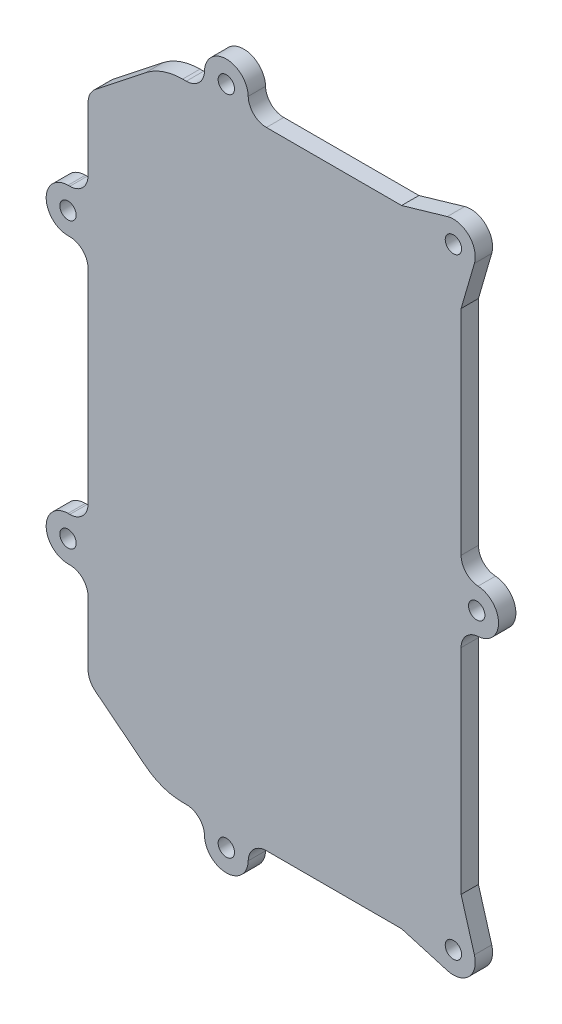
from build123d import *

# Parameters (mm, degrees)
BOSS_EXTRUDE1_DEPTH  = 4.7625
M4_CLEARANCE_HOLE1_D = 4.5


with BuildPart() as part:
    # Sketch1 → Boss-Extrude1 (new body)
    with BuildSketch(Plane.XY):
        with BuildLine():
            Line((-94.022602581, 36.539962058), (-94.022602581, 19.178370731))
            ThreePointArc((-94.022602581, 19.178370731), (-93.488675507, 16.852246076), (-91.993785217, 14.99180606))
            Line((-91.993785217, 14.99180606), (-78.162107839, 4.072060761))
            ThreePointArc((-78.162107839, 4.072060761), (-73.397757976, 1.461750489), (-68.040838029, 0.558335853))
            Line((-68.040838029, 0.558335853), (-67.038691488, 0.558335853))
            ThreePointArc((-67.038691488, 0.558335853), (-63.538253204, -0.87137959), (-62.039667189, -4.342891419))
            ThreePointArc((-62.039667189, -4.342891419), (-56.040838029, -10.224364147), (-50.04200887, -4.342891419))
            ThreePointArc((-50.04200887, -4.342891419), (-48.543422854, -0.87137959), (-45.04298457, 0.558335853))
            Line((-45.04298457, 0.558335853), (-7.916602581, 0.558335853))
            Line((-7.916602581, 0.558335853), (4.631523913, -3.09333052))
            ThreePointArc((4.631523913, -3.09333052), (10.550693091, -1.574959819), (12.069063792, 4.344209359))
            Line((12.069063792, 4.344209359), (8.417397419, 16.892335853))
            Line((8.417397419, 16.892335853), (8.417397419, 75.581748009))
            ThreePointArc((8.417397419, 75.581748009), (9.768409389, 79.000064314), (13.091351964, 80.57110612))
            ThreePointArc((13.091351964, 80.57110612), (18.700097419, 86.558335853), (13.091351964, 92.545565587))
            ThreePointArc((13.091351964, 92.545565587), (9.768409389, 94.116607393), (8.417397419, 97.534923698))
            Line((8.417397419, 97.534923698), (8.417397419, 156.224335853))
            Line((8.417397419, 156.224335853), (12.069063792, 168.772462348))
            ThreePointArc((12.069063792, 168.772462348), (10.550693091, 174.691631526), (4.631523913, 176.210002227))
            Line((4.631523913, 176.210002227), (-7.916602581, 172.558335853))
            Line((-7.916602581, 172.558335853), (-45.04298457, 172.558335853))
            ThreePointArc((-45.04298457, 172.558335853), (-48.543422854, 173.988051296), (-50.04200887, 177.459563126))
            ThreePointArc((-50.04200887, 177.459563126), (-56.040838029, 183.341035853), (-62.039667189, 177.459563126))
            ThreePointArc((-62.039667189, 177.459563126), (-63.538253204, 173.988051296), (-67.038691488, 172.558335853))
            Line((-67.038691488, 172.558335853), (-68.040838029, 172.558335853))
            ThreePointArc((-68.040838029, 172.558335853), (-73.397757976, 171.654921218), (-78.162107839, 169.044610946))
            Line((-78.162107839, 169.044610946), (-91.993785217, 158.124865647))
            ThreePointArc((-91.993785217, 158.124865647), (-93.488675507, 156.264425631), (-94.022602581, 153.938300976))
            Line((-94.022602581, 153.938300976), (-94.022602581, 136.576709649))
            ThreePointArc((-94.022602581, 136.576709649), (-95.487068676, 133.041175743), (-99.022602581, 131.576709649))
            Line((-99.022602581, 131.576709649), (-99.522602581, 131.576709649))
            ThreePointArc((-99.522602581, 131.576709649), (-105.522602581, 125.576709649), (-99.522602581, 119.576709649))
            Line((-99.522602581, 119.576709649), (-99.022602581, 119.576709649))
            ThreePointArc((-99.022602581, 119.576709649), (-95.487068676, 118.112243554), (-94.022602581, 114.576709649))
            Line((-94.022602581, 114.576709649), (-94.022602581, 58.539962058))
            ThreePointArc((-94.022602581, 58.539962058), (-95.487068676, 55.004428152), (-99.022602581, 53.539962058))
            Line((-99.022602581, 53.539962058), (-99.522602581, 53.539962058))
            ThreePointArc((-99.522602581, 53.539962058), (-105.522602581, 47.539962058), (-99.522602581, 41.539962058))
            Line((-99.522602581, 41.539962058), (-99.022602581, 41.539962058))
            ThreePointArc((-99.022602581, 41.539962058), (-95.487068676, 40.075495964), (-94.022602581, 36.539962058))
        make_face()
    extrude(amount=-BOSS_EXTRUDE1_DEPTH)

    # M4 Clearance Hole1 (through all)
    with Locations(Plane(origin=(0, 0, -4.7625), x_dir=(-1, 0, 0), z_dir=(0, 0, -1))):
        with Locations((-12.700097419, 86.558335853), (-6.308052404, 2.667680868), (-6.308052404, 170.448990839), (99.522602581, 47.539962058), (99.522602581, 125.576709649), (56.040838029, 177.341035853), (56.040838029, -4.224364147)):
            Hole(M4_CLEARANCE_HOLE1_D / 2)


solid = part.part
